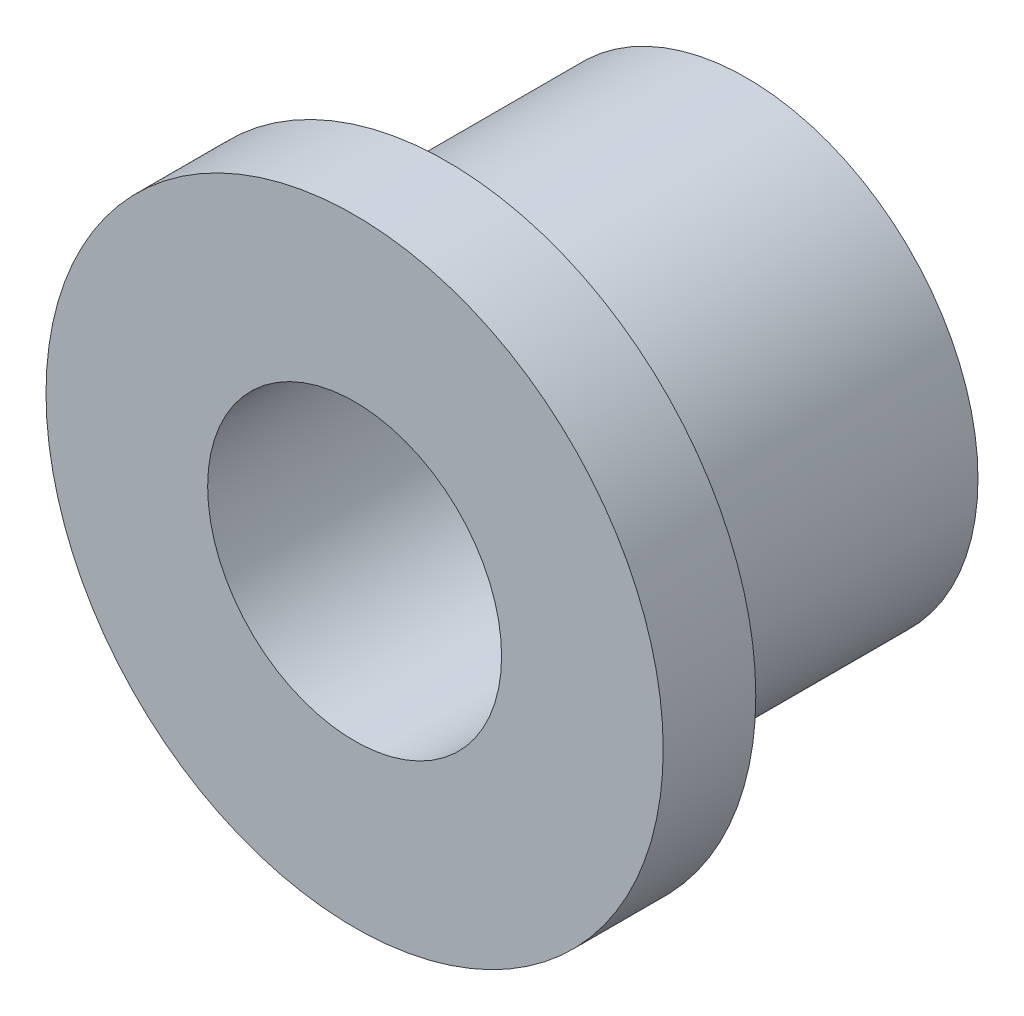
from build123d import *

# Parameters (mm, degrees)
SKETCH1_R           = 7.5
BOSS_EXTRUDE1_DEPTH = 6.35
SKETCH2_R           = 4.7625
CUT_EXTRUDE1_DEPTH  = 12.7
SKETCH3_R           = 10
SKETCH3_R_2         = 4.7625
BOSS_EXTRUDE2_DEPTH = 3


with BuildPart() as part:
    # Sketch1 → Boss-Extrude1 (new, symmetric)
    with BuildSketch(Plane.XY):
        Circle(SKETCH1_R)
    extrude(amount=BOSS_EXTRUDE1_DEPTH, both=True)

    # Sketch2 → Cut-Extrude1 (cut)
    with BuildSketch(Plane.XY.offset(6.35)):
        Circle(SKETCH2_R)
    extrude(amount=-CUT_EXTRUDE1_DEPTH, mode=Mode.SUBTRACT)

    # Sketch3 → Boss-Extrude2 (add)
    with BuildSketch(Plane.XY.offset(6.35)):
        Circle(SKETCH3_R)
        Circle(SKETCH3_R_2, mode=Mode.SUBTRACT)
    extrude(amount=-BOSS_EXTRUDE2_DEPTH)


solid = part.part
